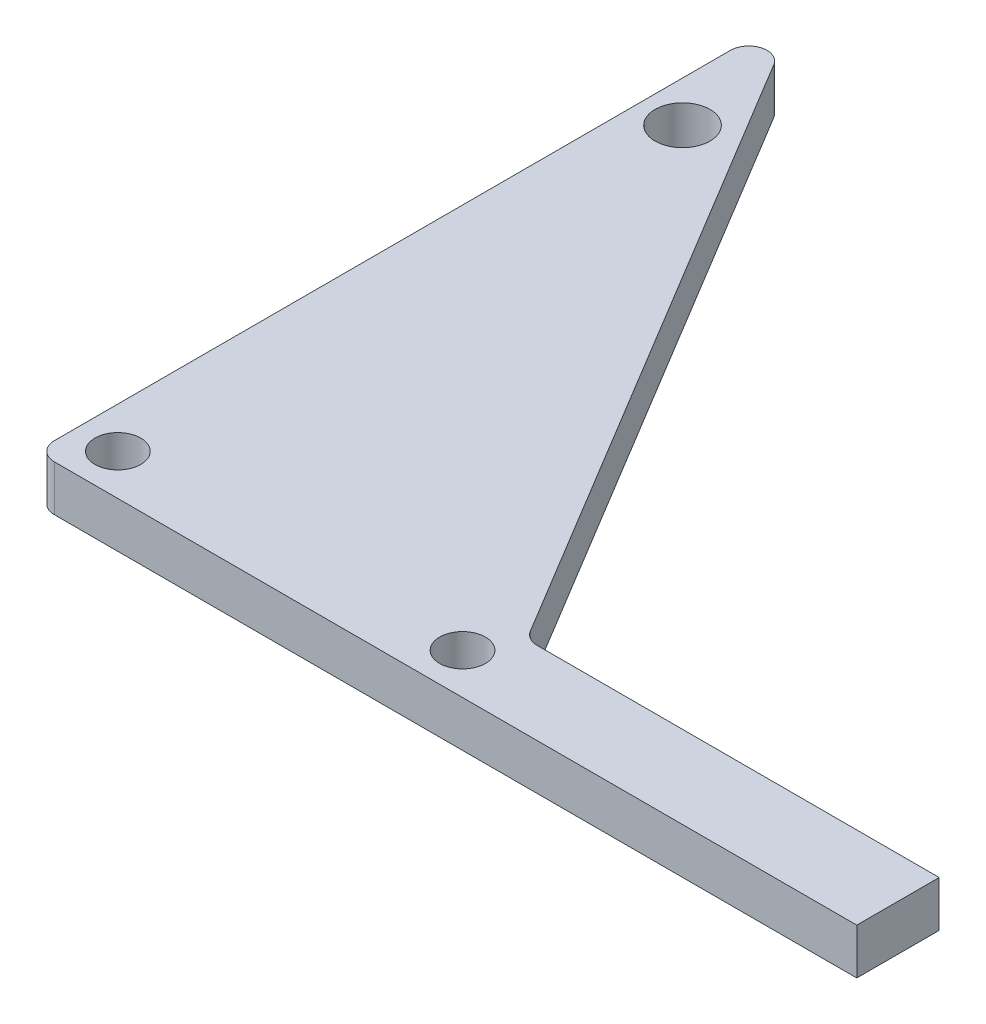
from build123d import *

# Parameters (mm, degrees)
BOSS_EXTRUDE1_DEPTH = 6.35
FILLET1_R           = 2.54
SKETCH3_R           = 3.81
SKETCH3_R_2         = 3.175
CUT_EXTRUDE1_DEPTH  = 118.627520719
SKETCH7_W           = 11.43
SKETCH7_H           = 6.35
BOSS_EXTRUDE3_DEPTH = 56.642
SKETCH8_W           = 0.889
SKETCH8_H           = 6.35
BOSS_EXTRUDE4_DEPTH = 1.27
FILLET2_R           = 2.54


with BuildPart() as part:
    # Sketch1 → Boss-Extrude1 (new body)
    with BuildSketch(Plane(origin=(0, 0, 0), x_dir=(1, 0, 0), z_dir=(0, 1, 0))):
        Polygon((0, 0), (0, 105.41), (63.5, 0), align=None)
    extrude(amount=BOSS_EXTRUDE1_DEPTH)

    # Fillet1
    fillet1_edges = [part.edges().sort_by_distance(p)[0] for p in [
        (0, 3.175, 0),
        (0, 3.175, -105.41),
    ]]
    fillet(fillet1_edges, radius=FILLET1_R)

    # Sketch3 → Cut-Extrude1 (cut, through all)
    with BuildSketch(Plane(origin=(0, 6.35, 0), x_dir=(1, 0, 0), z_dir=(0, 1, 0))):
        with Locations(Location((5.67299463, 83.963748496, 0), (0, 0, 270))):
            Circle(SKETCH3_R)
        with Locations(Location((5.67299463, 5.67299463, 0), (0, 0, 270))):
            Circle(SKETCH3_R_2)
        with Locations(Location((53.460687214, 5.67299463, 0), (0, 0, 270))):
            Circle(SKETCH3_R_2)
    extrude(amount=-CUT_EXTRUDE1_DEPTH, mode=Mode.SUBTRACT)

    # Sketch7 → Boss-Extrude3 (add)
    with BuildSketch(Plane(origin=(57.15, 0, 0), x_dir=(0, 0, -1), z_dir=(1, 0, 0))):
        with Locations((5.715, 3.175)):
            Rectangle(SKETCH7_W, SKETCH7_H)
    extrude(amount=BOSS_EXTRUDE3_DEPTH)

    # Sketch8 → Boss-Extrude4 (add)
    with BuildSketch(Plane(origin=(57.15, 0, 0), x_dir=(0, 0, -1), z_dir=(1, 0, 0))):
        with Locations((10.9855, 3.175)):
            Rectangle(SKETCH8_W, SKETCH8_H)
    extrude(amount=-BOSS_EXTRUDE4_DEPTH)

    # Fillet2
    fillet2_edges = [part.edges().sort_by_distance(p)[0] for p in [
        (56.614457831, 3.175, -11.43),
    ]]
    fillet(fillet2_edges, radius=FILLET2_R)


solid = part.part
